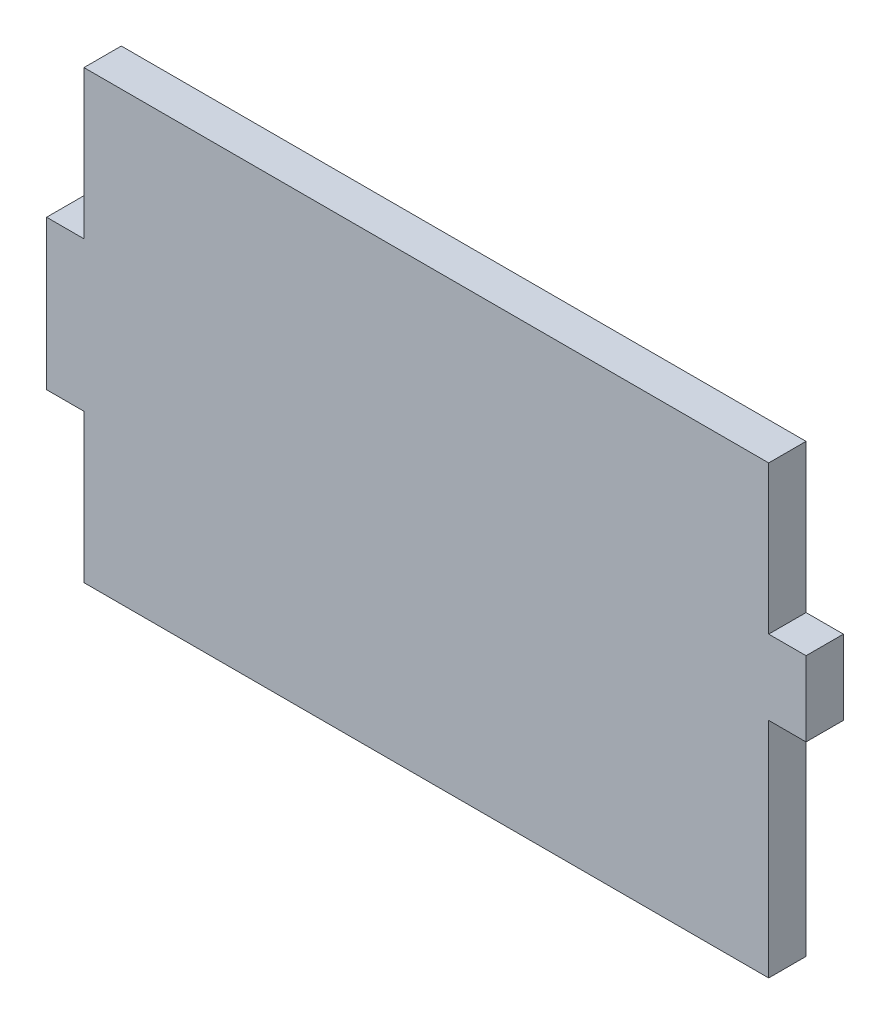
from build123d import *

# Parameters (mm, degrees)
P_IDAT_VYSUNUT_M1_DEPTH = 3


with BuildPart() as part:
    # Skica1 → Přidat vysunutím1 (new body)
    with BuildSketch(Plane.XY):
        Polygon((55, -17.91), (55, -35.83), (0, -35.83), (0, -23.91), (-3, -23.91), (-3, -11.91), (0, -11.91), (0, 0), (55, 0), (55, -11.91), (58, -11.91), (58, -17.91), align=None)
    extrude(amount=P_IDAT_VYSUNUT_M1_DEPTH)


solid = part.part
